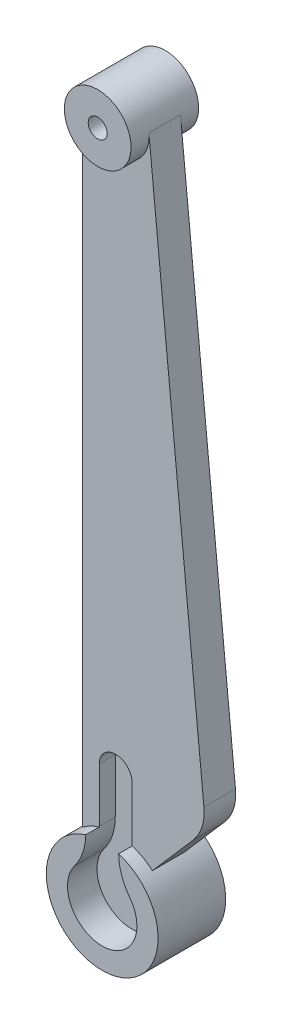
from build123d import *
from build123d.topology import SkipClean

# Parameters (mm, degrees)
BOSS_EXTRUDE3_DEPTH     = 2.5
SKETCH3_R               = 12.4
BOSS_EXTRUDE5_DEPTH     = 5
BOSS_EXTRUDE8_START     = 5
SKETCH5_R               = 12.4
BOSS_EXTRUDE8_DEPTH     = 5
BOSS_EXTRUDE11_START    = 2
BOSS_EXTRUDE11_DEPTH    = 2
CUT_EXTRUDE3_DEPTH      = 4.5
CUT_EXTRUDE3_DEPTH_BACK = 2.5
BOSS_EXTRUDE12_START    = -7
BOSS_EXTRUDE12_DEPTH    = 7
FILLET1_R               = 10
SKETCH11_R              = 7.4
BOSS_EXTRUDE13_DEPTH    = 7.5
CUT_EXTRUDE6_DEPTH      = 6.55
SKETCH13_R              = 2.1
CUT_EXTRUDE7_DEPTH      = 160.423505726
SKETCH14_R              = 4
BOSS_EXTRUDE15_DEPTH    = 5


with BuildPart() as part:
    # Sketch1 → Boss-Extrude3 (new, symmetric)
    with BuildSketch(Plane.XY):
        with BuildLine():
            Line((7.4, 140.050125629), (7.4, 9.949874371))
            ThreePointArc((7.4, 9.949874371), (0, -12.4), (-7.4, 9.949874371))
            Line((-7.4, 9.949874371), (-7.4, 140.050125629))
            ThreePointArc((-7.4, 140.050125629), (0, 162.4), (7.4, 140.050125629))
        make_face()
    extrude(amount=BOSS_EXTRUDE3_DEPTH, both=True)

    # Sketch3 → Boss-Extrude5 (add)
    with BuildSketch(Plane(origin=(0, 0, -2.5), x_dir=(-1, 0, 0), z_dir=(0, 0, -1))):
        Circle(SKETCH3_R)
    extrude(amount=BOSS_EXTRUDE5_DEPTH)

    # Sketch5 → Boss-Extrude8 (add)
    with SkipClean():  # the faces are left unmerged after this step: merging them gives an invalid solid
        with BuildSketch(Plane.XY.offset(2.5).offset(BOSS_EXTRUDE8_START)):
            with Locations(Location((0, 0, 0), (0, 0, 180))):
                Circle(SKETCH5_R)
        extrude(amount=-BOSS_EXTRUDE8_DEPTH)

    # Sketch6 → Boss-Extrude11 (add)
    with SkipClean():  # the faces are left unmerged after this step: merging them gives an invalid solid
        with BuildSketch(Plane.XY.offset(2.5).offset(BOSS_EXTRUDE11_START)):
            with BuildLine():
                Line((7.4, 9.949874371), (7.4, 140.050125629))
                ThreePointArc((7.4, 140.050125629), (0, 137.6), (-7.4, 140.050125629))
                Line((-7.4, 140.050125629), (-7.4, 9.949874371))
                ThreePointArc((-7.4, 9.949874371), (0, 12.4), (7.4, 9.949874371))
            make_face()
            with BuildLine():
                ThreePointArc((-7.4, 140.050125629), (0, 137.6), (7.4, 140.050125629))
                ThreePointArc((7.4, 140.050125629), (11.079711188, 144.432235637), (12.4, 150))
                ThreePointArc((12.4, 150), (-5.567764363, 161.079711188), (-7.4, 140.050125629))
            make_face()
        extrude(amount=-BOSS_EXTRUDE11_DEPTH)

    # Sketch7 → Cut-Extrude3 (cut, two sides: drawn at the far end of the back side and taken through both)
    with SkipClean():  # the faces are left unmerged after this step: merging them gives an invalid solid
        with BuildSketch(Plane.XY.offset(-CUT_EXTRUDE3_DEPTH_BACK)):
            with BuildLine():
                ThreePointArc((-7.4, 140.050125629), (0, 162.4), (7.4, 140.050125629))
                Line((7.4, 140.050125629), (7.4, 134.868658063))
                Line((7.4, 134.868658063), (31.123214722, 134.868658063))
                Line((31.123214722, 134.868658063), (31.123214722, 164.335219314))
                Line((31.123214722, 164.335219314), (-28.315462738, 164.335219314))
                Line((-28.315462738, 164.335219314), (-28.315462738, 134.868658063))
                Line((-28.315462738, 134.868658063), (-7.4, 134.868658063))
                Line((-7.4, 134.868658063), (-7.4, 140.050125629))
            make_face()
            with BuildLine():
                Line((7.4, 150), (7.4, 140.050125629))
                ThreePointArc((7.4, 140.050125629), (0, 162.4), (-7.4, 140.050125629))
                Line((-7.4, 140.050125629), (-7.4, 150))
                ThreePointArc((-7.4, 150), (0, 157.4), (7.4, 150))
            make_face()
        extrude(amount=CUT_EXTRUDE3_DEPTH + CUT_EXTRUDE3_DEPTH_BACK, mode=Mode.SUBTRACT)

    # Sketch10 → Boss-Extrude12 (add)
    with SkipClean():  # the faces are left unmerged after this step: merging them gives an invalid solid
        with BuildSketch(Plane(origin=(0, 0, -2.5), x_dir=(-1, 0, 0), z_dir=(0, 0, -1)).offset(BOSS_EXTRUDE12_START)):
            with BuildLine():
                Line((-20, 22.981333294), (0, 0))
                Line((0, 0), (0, 12.4))
                ThreePointArc((0, 12.4), (-3.897534977, 11.771542851), (-7.4, 9.949874371))
                Line((-7.4, 9.949874371), (-7.4, 150))
                ThreePointArc((-7.4, 150), (-7.391010284, 150.364646378), (-7.364062978, 150.728406792))
                Line((-7.364062978, 150.728406792), (-20, 22.981333294))
            make_face()
        extrude(amount=BOSS_EXTRUDE12_DEPTH)

    # Fillet1
    fillet1_edges = [part.edges().sort_by_distance(p)[0] for p in [
        (20, 22.981333294, 1),
    ]]
    fillet(fillet1_edges, radius=FILLET1_R)

    # Sketch11 → Boss-Extrude13 (add, symmetric)
    with SkipClean():  # the faces are left unmerged after this step: merging them gives an invalid solid
        with BuildSketch(Plane.XY.offset(1)):
            with Locations((0, 150)):
                Circle(SKETCH11_R)
        extrude(amount=BOSS_EXTRUDE13_DEPTH, both=True)

    # Sketch12 → Cut-Extrude6 (cut)
    with SkipClean():  # the faces are left unmerged after this step: merging them gives an invalid solid
        with BuildSketch(Plane.XY.offset(7.5)):
            with BuildLine():
                Line((-3.65, 24), (-3.65, 12))
                ThreePointArc((-3.65, 12), (-4.285489279, 8.129790131), (-6.125220929, 4.666012063))
                ThreePointArc((-6.125220929, 4.666012063), (0, -7.7), (6.125220929, 4.666012063))
                ThreePointArc((6.125220929, 4.666012063), (4.285489279, 8.129790131), (3.65, 12))
                Line((3.65, 12), (3.65, 24))
                ThreePointArc((3.65, 24), (0, 27.65), (-3.65, 24))
            make_face()
        extrude(amount=-CUT_EXTRUDE6_DEPTH, mode=Mode.SUBTRACT)

    # Sketch13 → Cut-Extrude7 (cut, through all)
    with SkipClean():  # the faces are left unmerged after this step: merging them gives an invalid solid
        with BuildSketch(Plane.XY.offset(8.5)):
            with Locations((0, 150)):
                Circle(SKETCH13_R)
        extrude(amount=-CUT_EXTRUDE7_DEPTH, mode=Mode.SUBTRACT)

    # Sketch14 → Boss-Extrude15 (add)
    with SkipClean():  # the faces are left unmerged after this step: merging them gives an invalid solid
        with BuildSketch(Plane(origin=(0, 0, -7.5), x_dir=(-1, 0, 0), z_dir=(0, 0, -1))):
            Circle(SKETCH14_R)
        extrude(amount=BOSS_EXTRUDE15_DEPTH)


solid = part.part
